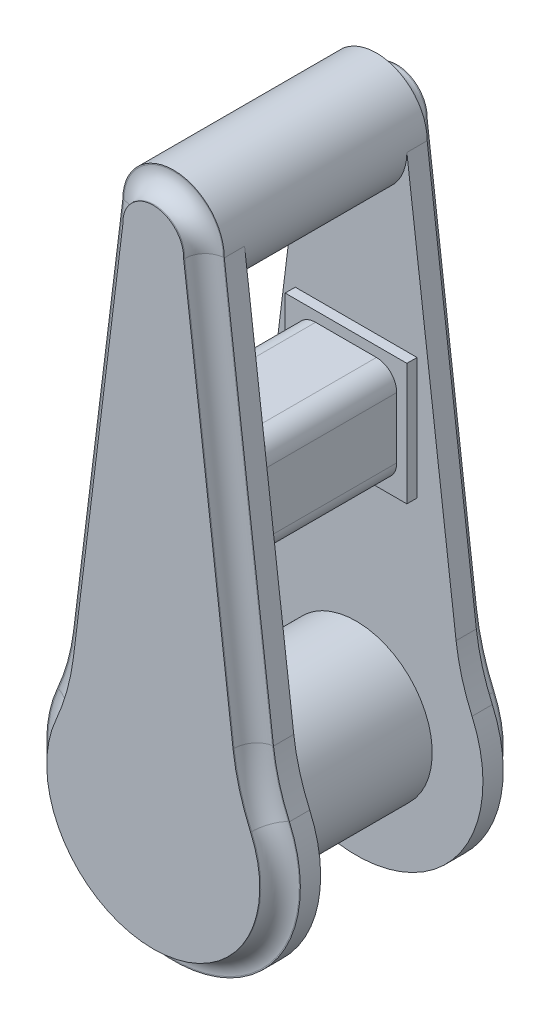
from build123d import *

# Parameters (mm, degrees)
IZIM1_R                       = 75
Y_KSEKLIK_EKSTR_ZYON1_DEPTH   = 180
IZIM1_R_2                     = 50
Y_KSEKLIK_EKSTR_ZYON1_2_DEPTH = 180
Y_KSEKLIK_EKSTR_ZYON2_DEPTH   = 20
Y_KSEKLIK_EKSTR_ZYON3_DEPTH   = 20
RADYUS1_R                     = 19
RADYUS1_OF_AYNALAMA1_R        = 19
IZIM4_W                       = 120
IZIM4_H                       = 120
Y_KSEKLIK_EKSTR_ZYON4_DEPTH   = 10
Y_KSEKLIK_EKSTR_ZYON5_REACH   = 597.168
IZIM6_W                       = 100
IZIM6_H                       = 100
RADYUS2_R                     = 20


with BuildPart() as part:
    # Çizim1 → Yükseklik-Ekstrüzyon1 (new body)
    with BuildSketch(Plane.XY):
        with Locations(Location((0, 0, 0), (0, 0, 180))):
            Circle(IZIM1_R)
    extrude(amount=Y_KSEKLIK_EKSTR_ZYON1_DEPTH)



with BuildPart() as body_2:
    # Çizim1 → Y_kseklik-Ekstr_zyon1 2 (new body)
    with BuildSketch(Plane.XY):
        with Locations(Location((0, 500, 0), (0, 0, 180))):
            Circle(IZIM1_R_2)
    extrude(amount=Y_KSEKLIK_EKSTR_ZYON1_2_DEPTH)


with BuildPart() as part_1:
    add(part.part)

    add(body_2.part)  # Yükseklik-Ekstrüzyon2 merges body 2
    # Çizim2 → Yükseklik-Ekstrüzyon2 (add)
    with BuildSketch(Plane.XY):
        with BuildLine():
            Line((50, 500), (98.495702008, 107.476734806))
            ThreePointArc((98.495702008, 107.476734806), (104.263508371, 78.541265575), (114.225589108, 50.769230769))
            ThreePointArc((114.225589108, 50.769230769), (0, -125), (-114.225589108, 50.769230769))
            ThreePointArc((-114.225589108, 50.769230769), (-104.263508371, 78.541265575), (-98.495702008, 107.476734806))
            Line((-98.495702008, 107.476734806), (-50, 500))
            ThreePointArc((-50, 500), (0, 550), (50, 500))
        make_face()
    y_kseklik_ekstr_zyon2 = extrude(amount=-Y_KSEKLIK_EKSTR_ZYON2_DEPTH)

    # Çizim3 → Yükseklik-Ekstrüzyon3 (add)
    with BuildSketch(Plane(origin=(0, 0, -20), x_dir=(-1, 0, 0), z_dir=(0, 0, -1))):
        with BuildLine():
            Line((-29.98073719, 498.925105803), (-78.646619041, 105.024408287))
            ThreePointArc((-78.646619041, 105.024408287), (-84.99120604, 73.195392132), (-95.949494851, 42.646153846))
            ThreePointArc((-95.949494851, 42.646153846), (0, -105), (95.949494851, 42.646153846))
            ThreePointArc((95.949494851, 42.646153846), (84.99120604, 73.195392132), (78.646619041, 105.024408287))
            Line((78.646619041, 105.024408287), (29.98073719, 498.925105803))
            ThreePointArc((29.98073719, 498.925105803), (0, 530), (-29.98073719, 498.925105803))
        make_face()
    y_kseklik_ekstr_zyon3 = extrude(amount=Y_KSEKLIK_EKSTR_ZYON3_DEPTH)

    # Radyus1
    radyus1_edges = [part_1.edges().sort_by_distance(p)[0] for p in [
        (0, 530, -20),
        (54.313678116, 301.974757045, -20),
        (84.99120604, 73.195392132, -20),
        (0, -105, -20),
        (-84.99120604, 73.195392132, -20),
        (-54.313678116, 301.974757045, -20),
    ]]
    fillet(radyus1_edges, radius=RADYUS1_R)

    # Aynalama1: Yükseklik-Ekstrüzyon2, Yükseklik-Ekstrüzyon3 across plane
    add(y_kseklik_ekstr_zyon2.mirror(Plane.XY.offset(80)))
    add(y_kseklik_ekstr_zyon3.mirror(Plane.XY.offset(80)))

    # Radyus1 of Aynalama1
    radyus1_of_aynalama1_edges = [part_1.edges().sort_by_distance(p)[0] for p in [
        (0, 530, 180),
        (54.313678116, 301.974757045, 180),
        (84.99120604, 73.195392132, 180),
        (0, -105, 180),
        (-84.99120604, 73.195392132, 180),
        (-54.313678116, 301.974757045, 180),
    ]]
    fillet(radyus1_of_aynalama1_edges, radius=RADYUS1_OF_AYNALAMA1_R)

    # Çizim4 → Yükseklik-Ekstrüzyon4 (add)
    with BuildSketch(Plane(origin=(0, 0, 160), x_dir=(-1, 0, 0), z_dir=(0, 0, -1))):
        with Locations((0, 270)):
            Rectangle(IZIM4_W, IZIM4_H)
    y_kseklik_ekstr_zyon4 = extrude(amount=Y_KSEKLIK_EKSTR_ZYON4_DEPTH)

    # Aynalama2: Yükseklik-Ekstrüzyon4 across plane
    add(y_kseklik_ekstr_zyon4.mirror(Plane.XY.offset(80)))

    # Çizim6 → Yükseklik-Ekstrüzyon5 (add, up to next)
    with BuildSketch(Plane(origin=(0, 0, 150), x_dir=(-1, 0, 0), z_dir=(0, 0, -1)), mode=Mode.PRIVATE) as y_kseklik_ekstr_zyon5_sk1:
        with Locations((0, 270)):
            Rectangle(IZIM6_W, IZIM6_H)
    y_kseklik_ekstr_zyon5_tool1 = extrude(y_kseklik_ekstr_zyon5_sk1.sketch, amount=Y_KSEKLIK_EKSTR_ZYON5_REACH, mode=Mode.PRIVATE) - part_1.part
    add(y_kseklik_ekstr_zyon5_tool1.solids().sort_by_distance((0, 270, 150))[0])

    # Radyus2
    radyus2_edges = [part_1.edges().sort_by_distance(p)[0] for p in [
        (50, 320, 80),
        (-50, 320, 80),
        (50, 220, 80),
        (-50, 220, 80),
    ]]
    fillet(radyus2_edges, radius=RADYUS2_R)


solid = part_1.part
